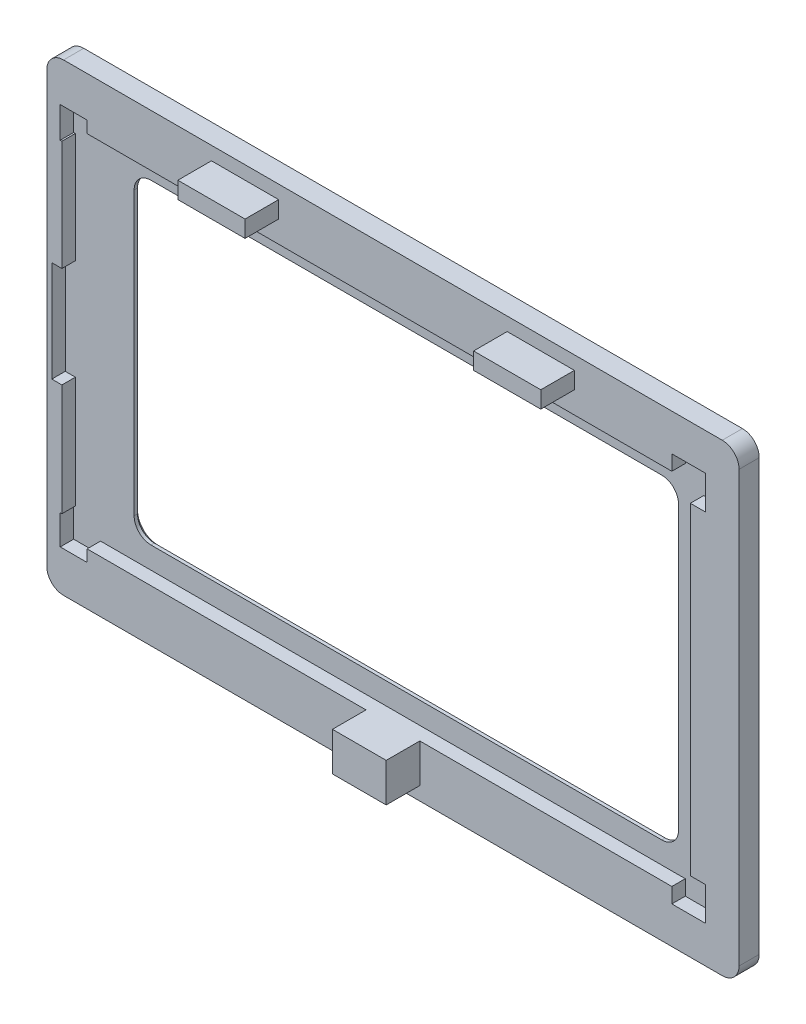
from build123d import *

# Parameters (mm, degrees)
SKETCH1_W           = 103
SKETCH1_H           = 69
BOSS_EXTRUDE1_DEPTH = 3
SKETCH2_W           = 81
SKETCH2_H           = 47
CUT_EXTRUDE1_DEPTH  = 3
CUT_EXTRUDE2_DEPTH  = 2
FILLET2_R           = 2.5
FILLET3_R           = 2.5
CHAMFER1_SIZE       = 0.5
CUT_EXTRUDE3_DEPTH  = 2
SKETCH5_W           = 10
SKETCH5_H           = 2.5
BOSS_EXTRUDE2_DEPTH = 5
SKETCH6_W           = 8
SKETCH6_H           = 5.75
BOSS_EXTRUDE3_DEPTH = 5


with BuildPart() as part:
    # Sketch1 → Boss-Extrude1 (new body)
    with BuildSketch(Plane.XY):
        with Locations((62.328366078, 28.443882797)):
            Rectangle(SKETCH1_W, SKETCH1_H)
    extrude(amount=BOSS_EXTRUDE1_DEPTH)

    # Sketch2 → Cut-Extrude1 (cut)
    with BuildSketch(Plane.XY.offset(3)):
        with Locations((62.328366078, 28.443882797)):
            Rectangle(SKETCH2_W, SKETCH2_H)
    extrude(amount=-CUT_EXTRUDE1_DEPTH, mode=Mode.SUBTRACT)

    # Sketch3 → Cut-Extrude2 (cut)
    with BuildSketch(Plane.XY.offset(3)):
        Polygon((13.078366078, 55.193882797), (106.578366078, 55.193882797), (106.578366078, 1.693882797), (13.078366078, 1.693882797), (13.078366078, 20.943882797), (11.578366078, 20.943882797), (11.578366078, 35.943882797), (13.078366078, 35.943882797), align=None)
    extrude(amount=-CUT_EXTRUDE2_DEPTH, mode=Mode.SUBTRACT)

    # Fillet2
    fillet2_edges = [part.edges().sort_by_distance(p)[0] for p in [
        (113.828366078, -6.056117203, 1.5),
        (10.828366078, -6.056117203, 1.5),
        (10.828366078, 62.943882797, 1.5),
        (113.828366078, 62.943882797, 1.5),
    ]]
    fillet(fillet2_edges, radius=FILLET2_R)

    # Fillet3
    fillet3_edges = [part.edges().sort_by_distance(p)[0] for p in [
        (21.828366078, 4.943882797, 0.5),
        (21.828366078, 51.943882797, 0.5),
        (102.828366078, 51.943882797, 0.5),
        (102.828366078, 4.943882797, 0.5),
    ]]
    fillet(fillet3_edges, radius=FILLET3_R)

    # Chamfer1
    chamfer1_edges = [part.edges().sort_by_distance(p)[0] for p in [
        (62.328366078, 4.943882797, 0),
        (102.828366078, 28.443882797, 0),
        (22.560599125, 51.21164975, 0),
        (22.560599125, 5.676115844, 0),
        (102.096133031, 5.676115844, 0),
        (102.096133031, 51.21164975, 0),
        (21.828366078, 28.443882797, 0),
        (62.328366078, 51.943882797, 0),
    ]]
    chamfer(chamfer1_edges, length=CHAMFER1_SIZE)

    # Sketch4 → Cut-Extrude3 (cut)
    with BuildSketch(Plane.XY.offset(3)):
        Polygon((16.828366078, 55.193882797), (16.828366078, 56.943882797), (12.828366078, 56.943882797), (12.828366078, 52.343882797), (13.078366078, 52.343882797), (13.078366078, 55.193882797), align=None)
        Polygon((103.828366078, 55.193882797), (103.828366078, 57.443882797), (108.828366078, 57.443882797), (108.828366078, 52.443882797), (106.578366078, 52.443882797), (106.578366078, 55.193882797), align=None)
        Polygon((16.828366078, 1.693882797), (16.828366078, -0.056117203), (12.828366078, -0.056117203), (12.828366078, 4.343882797), (13.078366078, 4.343882797), (13.078366078, 1.693882797), align=None)
        Polygon((103.828366078, 1.693882797), (103.828366078, -0.556117203), (108.828366078, -0.556117203), (108.828366078, 4.443882797), (106.578366078, 4.443882797), (106.578366078, 1.693882797), align=None)
    extrude(amount=-CUT_EXTRUDE3_DEPTH, mode=Mode.SUBTRACT)

    # Sketch5 → Boss-Extrude2 (add)
    with BuildSketch(Plane.XY.offset(3)):
        with Locations((84.328366078, 59.693882797)):
            Rectangle(SKETCH5_W, SKETCH5_H)
        with Locations((40.328366078, 59.693882797)):
            Rectangle(SKETCH5_W, SKETCH5_H)
    extrude(amount=BOSS_EXTRUDE2_DEPTH)

    # Sketch6 → Boss-Extrude3 (add)
    with BuildSketch(Plane.XY.offset(3)):
        with Locations((62.328366078, -1.181117203)):
            Rectangle(SKETCH6_W, SKETCH6_H)
    extrude(amount=BOSS_EXTRUDE3_DEPTH)


solid = part.part
